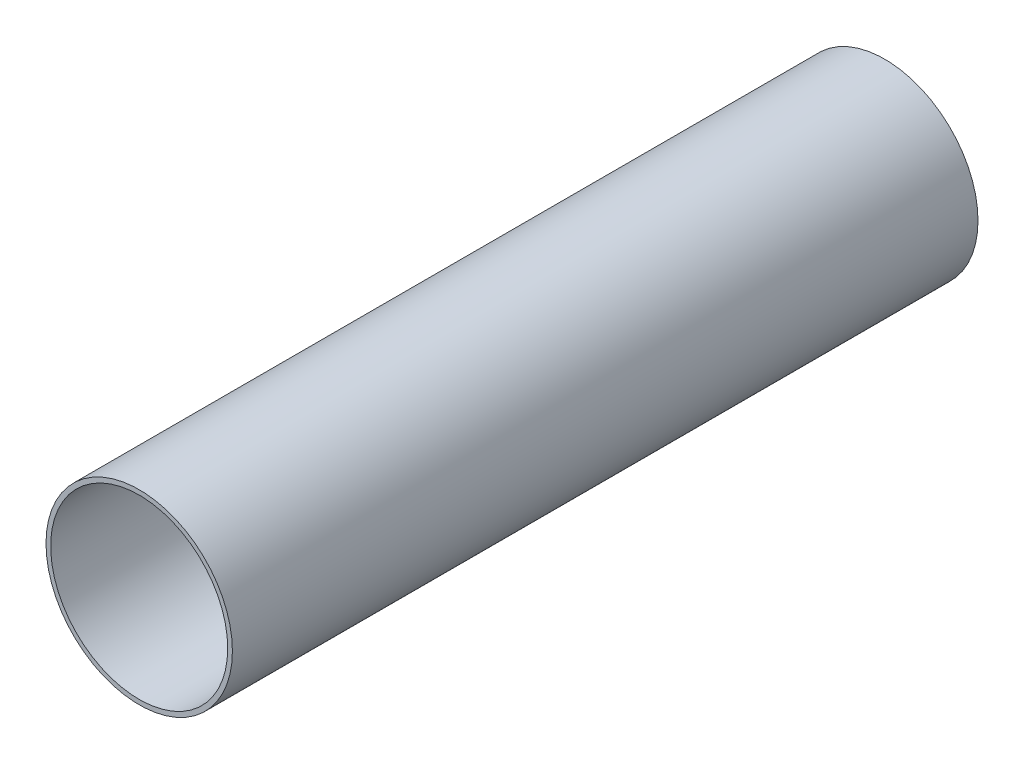
from build123d import *

# Parameters (mm, degrees)
SKETCH1_R           = 63.5
SKETCH1_R_2         = 60.325
BOSS_EXTRUDE1_DEPTH = 508


with BuildPart() as part:
    # Sketch1 → Boss-Extrude1 (new body)
    with BuildSketch(Plane.XY):
        Circle(SKETCH1_R)
        Circle(SKETCH1_R_2, mode=Mode.SUBTRACT)
    extrude(amount=-BOSS_EXTRUDE1_DEPTH)


solid = part.part
